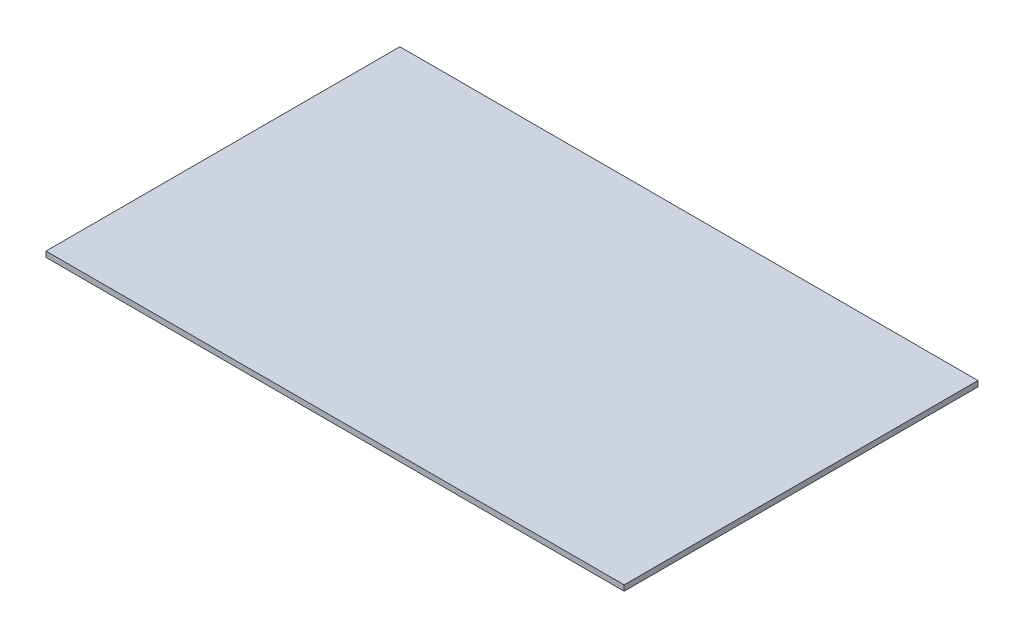
from build123d import *

# Parameters (mm, degrees)
SKETCH1_W           = 312.93200691
SKETCH1_H           = 191.545570066
BOSS_EXTRUDE1_DEPTH = 3


with BuildPart() as part:
    # Sketch1 → Boss-Extrude1 (new body)
    with BuildSketch(Plane(origin=(0, 0, 0), x_dir=(1, 0, 0), z_dir=(0, 1, 0))):
        Rectangle(SKETCH1_W, SKETCH1_H)
    extrude(amount=BOSS_EXTRUDE1_DEPTH)


solid = part.part
